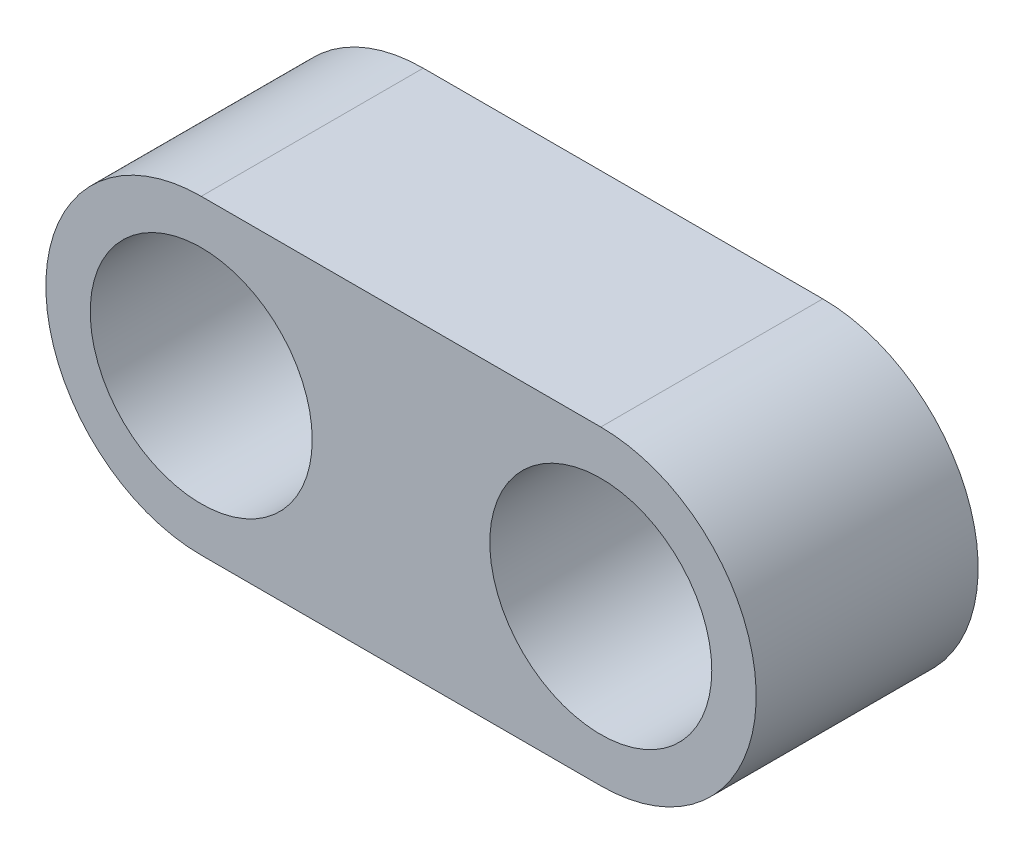
from build123d import *

# Parameters (mm, degrees)
SKETCH2_R           = 5
BOSS_EXTRUDE1_DEPTH = 10


with BuildPart() as part:
    # Sketch2 → Boss-Extrude1 (new body)
    with BuildSketch(Plane.XY):
        with BuildLine():
            Line((-9, 7), (9, 7))
            ThreePointArc((9, 7), (16, 0), (9, -7))
            Line((9, -7), (-9, -7))
            ThreePointArc((-9, -7), (-16, 0), (-9, 7))
        make_face()
        with Locations((-9, 0)):
            Circle(SKETCH2_R, mode=Mode.SUBTRACT)
        with Locations((9, 0)):
            Circle(SKETCH2_R, mode=Mode.SUBTRACT)
    extrude(amount=BOSS_EXTRUDE1_DEPTH)


solid = part.part
